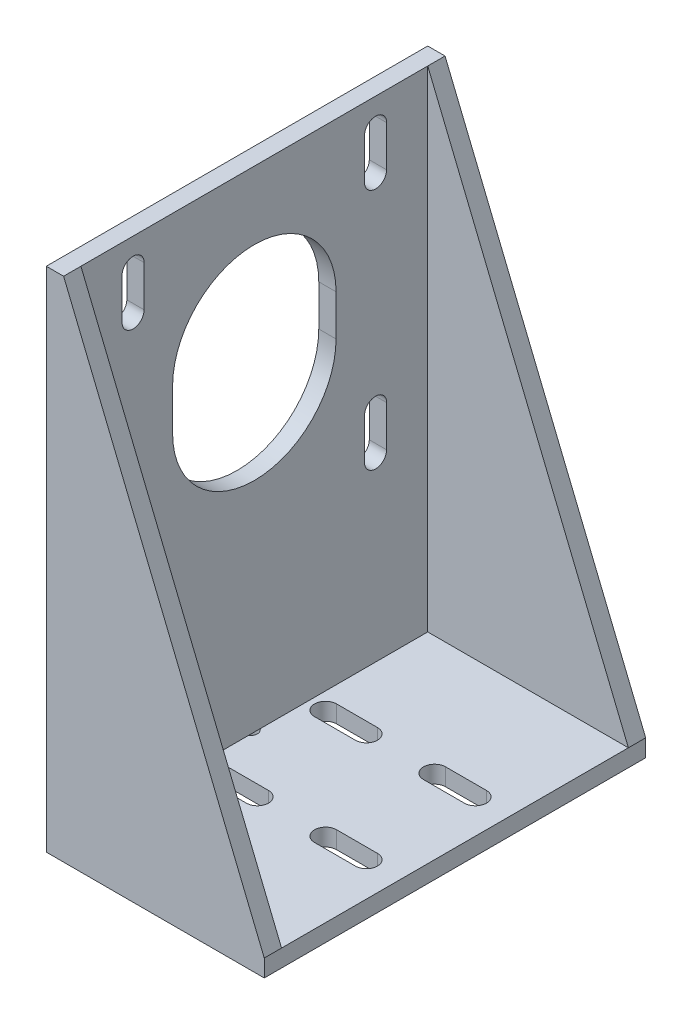
from build123d import *

# Parameters (mm, degrees)
SKETCH1_W                = 80
SKETCH1_H                = 140
SKETCH1_R                = 2.5
BOSS_EXTRUDE1_DEPTH      = 6.35
SKETCH3_W                = 140
SKETCH3_H                = 179.9
BOSS_EXTRUDE2_DEPTH      = 6.35
BOSS_EXTRUDE3_DEPTH      = 70
BOSS_EXTRUDE3_DEPTH_BACK = 70
CUT_EXTRUDE1_DEPTH       = 63.65
CUT_EXTRUDE1_DEPTH_BACK  = 63.65


with BuildPart() as part:
    # Sketch1 → Boss-Extrude1 (new body)
    with BuildSketch(Plane(origin=(0, 0, 0), x_dir=(1, 0, 0), z_dir=(0, 1, 0))):
        with Locations((40, 0)):
            Rectangle(SKETCH1_W, SKETCH1_H)
        with Locations(Location((5, 0, 0), (0, 0, 270))):
            Circle(SKETCH1_R, mode=Mode.SUBTRACT)
        with BuildLine():
            Line((12.5, 24.05), (27.5, 24.05))
            ThreePointArc((27.5, 24.05), (31.55, 20), (27.5, 15.95))
            Line((27.5, 15.95), (12.5, 15.95))
            ThreePointArc((12.5, 15.95), (8.45, 20), (12.5, 24.05))
        make_face(mode=Mode.SUBTRACT)
        with BuildLine():
            Line((52.5, 24.05), (67.5, 24.05))
            ThreePointArc((67.5, 24.05), (71.55, 20), (67.5, 15.95))
            Line((67.5, 15.95), (52.5, 15.95))
            ThreePointArc((52.5, 15.95), (48.45, 20), (52.5, 24.05))
        make_face(mode=Mode.SUBTRACT)
        with BuildLine():
            Line((52.5, -15.95), (67.5, -15.95))
            ThreePointArc((67.5, -15.95), (71.55, -20), (67.5, -24.05))
            Line((67.5, -24.05), (52.5, -24.05))
            ThreePointArc((52.5, -24.05), (48.45, -20), (52.5, -15.95))
        make_face(mode=Mode.SUBTRACT)
        with BuildLine():
            Line((12.5, -15.95), (27.5, -15.95))
            ThreePointArc((27.5, -15.95), (31.55, -20), (27.5, -24.05))
            Line((27.5, -24.05), (12.5, -24.05))
            ThreePointArc((12.5, -24.05), (8.45, -20), (12.5, -15.95))
        make_face(mode=Mode.SUBTRACT)
    extrude(amount=-BOSS_EXTRUDE1_DEPTH)

    # Sketch3 → Boss-Extrude2 (add)
    with BuildSketch(Plane(origin=(0, 0, 0), x_dir=(0, 0, -1), z_dir=(1, 0, 0))):
        with Locations((0, 89.95)):
            Rectangle(SKETCH3_W, SKETCH3_H)
        with BuildLine():
            Line((-40.45, 169.45), (-40.45, 154.45))
            ThreePointArc((-40.45, 154.45), (-44.5, 150.4), (-48.55, 154.45))
            Line((-48.55, 154.45), (-48.55, 169.45))
            ThreePointArc((-48.55, 169.45), (-44.5, 173.5), (-40.45, 169.45))
        make_face(mode=Mode.SUBTRACT)
        with BuildLine():
            Line((48.55, 169.45), (48.55, 154.45))
            ThreePointArc((48.55, 154.45), (44.5, 150.4), (40.45, 154.45))
            Line((40.45, 154.45), (40.45, 169.45))
            ThreePointArc((40.45, 169.45), (44.5, 173.5), (48.55, 169.45))
        make_face(mode=Mode.SUBTRACT)
        with BuildLine():
            Line((48.55, 80.45), (48.55, 65.45))
            ThreePointArc((48.55, 65.45), (44.5, 61.4), (40.45, 65.45))
            Line((40.45, 65.45), (40.45, 80.45))
            ThreePointArc((40.45, 80.45), (44.5, 84.5), (48.55, 80.45))
        make_face(mode=Mode.SUBTRACT)
        with BuildLine():
            Line((-40.45, 80.45), (-40.45, 65.45))
            ThreePointArc((-40.45, 65.45), (-44.5, 61.4), (-48.55, 65.45))
            Line((-48.55, 65.45), (-48.55, 80.45))
            ThreePointArc((-48.55, 80.45), (-44.5, 84.5), (-40.45, 80.45))
        make_face(mode=Mode.SUBTRACT)
        with BuildLine():
            Line((30, 124.95), (30, 109.95))
            ThreePointArc((30, 109.95), (0, 79.95), (-30, 109.95))
            Line((-30, 109.95), (-30, 124.95))
            ThreePointArc((-30, 124.95), (0, 154.95), (30, 124.95))
        make_face(mode=Mode.SUBTRACT)
    extrude(amount=BOSS_EXTRUDE2_DEPTH)

    # Sketch4 → Boss-Extrude3 (add, two sides: drawn at the far end of the back side and taken through both)
    with BuildSketch(Plane.XY.offset(-BOSS_EXTRUDE3_DEPTH_BACK)):
        Polygon((6.35, 179.9), (80, 0), (6.35, 0), align=None)
    extrude(amount=BOSS_EXTRUDE3_DEPTH + BOSS_EXTRUDE3_DEPTH_BACK)

    # Sketch5 → Cut-Extrude1 (cut, two sides: drawn at the far end of the back side and taken through both)
    with BuildSketch(Plane.XY.offset(-CUT_EXTRUDE1_DEPTH_BACK)):
        Polygon((6.35, 179.9), (80, 0), (6.35, 0), align=None)
    extrude(amount=CUT_EXTRUDE1_DEPTH + CUT_EXTRUDE1_DEPTH_BACK, mode=Mode.SUBTRACT)


solid = part.part
